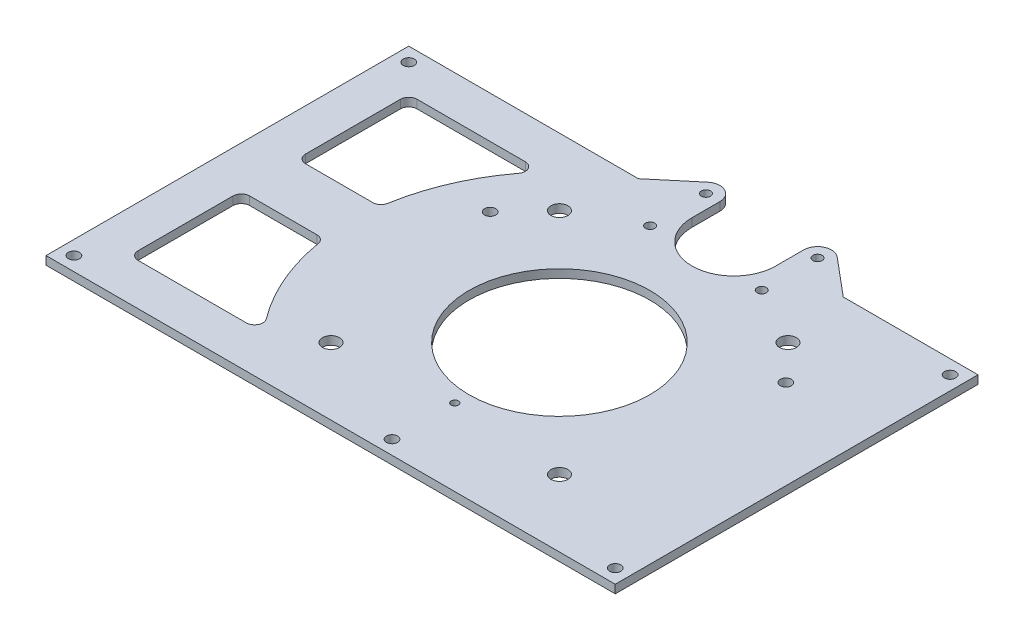
from build123d import *

# Parameters (mm, degrees)
SKETCH_1_R          = 2
SKETCH_1_R_2        = 3.05
SKETCH_1_R_3        = 1.3
SKETCH_1_R_4        = 32.4
SKETCH_1_R_5        = 1.65
EXTRUDE_1_DEPTH     = 3
CUT_EXTRUDE_1_DEPTH = 249.859900346
FILLET_1_R          = 3


with BuildPart() as part:
    # ｽｹｯﾁ1 → ﾎﾞｽ - 押し出し1 (new body)
    with BuildSketch(Plane(origin=(0, 0, 0), x_dir=(1, 0, 0), z_dir=(0, 1, 0))):
        with BuildLine():
            Line((0, 130), (0, 0))
            Line((0, 0), (204, 0))
            Line((204, 0), (204, 130))
            Line((204, 130), (155.716771079, 130))
            Line((155.716771079, 130), (142.213938048, 141.330222216))
            ThreePointArc((142.213938048, 141.330222216), (136.886908691, 142.031538935), (134, 137.5))
            Line((134, 137.5), (134, 127.5))
            ThreePointArc((134, 127.5), (119, 112.5), (104, 127.5))
            Line((104, 127.5), (104, 130))
            Line((104, 130), (104, 137.5))
            ThreePointArc((104, 137.5), (101.113091309, 142.031538935), (95.786061952, 141.330222216))
            Line((95.786061952, 141.330222216), (82.283228921, 130))
            Line((82.283228921, 130), (0, 130))
        make_face()
        with Locations(Location((5, 5, 0), (0, 0, 270))):
            Circle(SKETCH_1_R, mode=Mode.SUBTRACT)
        with Locations(Location((78.058517369, 24.058517369, 0), (0, 0, 270))):
            Circle(SKETCH_1_R_2, mode=Mode.SUBTRACT)
        with Locations(Location((119, 5, 0), (0, 0, 270))):
            Circle(SKETCH_1_R, mode=Mode.SUBTRACT)
        with Locations(Location((119, 27.5, 0), (0, 0, 270))):
            Circle(SKETCH_1_R_3, mode=Mode.SUBTRACT)
        with Locations(Location((199, 5, 0), (0, 0, 270))):
            Circle(SKETCH_1_R, mode=Mode.SUBTRACT)
        with Locations(Location((159.941482631, 24.058517369, 0), (0, 0, 270))):
            Circle(SKETCH_1_R_2, mode=Mode.SUBTRACT)
        with Locations(Location((119, 65, 0), (0, 0, 270))):
            Circle(SKETCH_1_R_4, mode=Mode.SUBTRACT)
        with Locations(Location((66.023144428, 93.168293767, 0), (0, 0, 270))):
            Circle(SKETCH_1_R, mode=Mode.SUBTRACT)
        with Locations(Location((5, 125, 0), (0, 0, 270))):
            Circle(SKETCH_1_R, mode=Mode.SUBTRACT)
        with Locations(Location((78.058517369, 105.941482631, 0), (0, 0, 270))):
            Circle(SKETCH_1_R_2, mode=Mode.SUBTRACT)
        with Locations(Location((99, 117.5, 0), (0, 0, 270))):
            Circle(SKETCH_1_R_5, mode=Mode.SUBTRACT)
        with Locations(Location((99, 137.5, 0), (0, 0, 270))):
            Circle(SKETCH_1_R_5, mode=Mode.SUBTRACT)
        with Locations(Location((171.976855572, 93.168293767, 0), (0, 0, 270))):
            Circle(SKETCH_1_R, mode=Mode.SUBTRACT)
        with Locations(Location((139, 117.5, 0), (0, 0, 270))):
            Circle(SKETCH_1_R_5, mode=Mode.SUBTRACT)
        with Locations(Location((159.941482631, 105.941482631, 0), (0, 0, 270))):
            Circle(SKETCH_1_R_2, mode=Mode.SUBTRACT)
        with Locations(Location((199, 125, 0), (0, 0, 270))):
            Circle(SKETCH_1_R, mode=Mode.SUBTRACT)
        with Locations(Location((139, 137.5, 0), (0, 0, 270))):
            Circle(SKETCH_1_R_5, mode=Mode.SUBTRACT)
    extrude(amount=EXTRUDE_1_DEPTH)

    # ｽｹｯﾁ2 → ｶｯﾄ - 押し出し1 (cut, through all)
    with BuildSketch(Plane(origin=(0, 3, 0), x_dir=(1, 0, 0), z_dir=(0, 1, 0))):
        with BuildLine():
            ThreePointArc((44.669656263, 75), (50.881747913, 96.383175949), (63.098300563, 115))
            Line((63.098300563, 115), (15, 115))
            Line((15, 115), (15, 75))
            Line((15, 75), (44.669656263, 75))
        make_face()
        with BuildLine():
            Line((15, 15), (63.098300563, 15))
            ThreePointArc((63.098300563, 15), (50.881747913, 33.616824051), (44.669656263, 55))
            Line((44.669656263, 55), (15, 55))
            Line((15, 55), (15, 15))
        make_face()
    extrude(amount=-CUT_EXTRUDE_1_DEPTH, mode=Mode.SUBTRACT)

    # ﾌｨﾚｯﾄ1
    fillet_1_edges = [part.edges().sort_by_distance(p)[0] for p in [
        (63.098300563, 1.5, -115),
        (44.669656263, 1.5, -75),
        (15, 1.5, -75),
        (15, 1.5, -115),
        (44.669656263, 1.5, -55),
        (63.098300563, 1.5, -15),
        (15, 1.5, -15),
        (15, 1.5, -55),
    ]]
    fillet(fillet_1_edges, radius=FILLET_1_R)


solid = part.part
